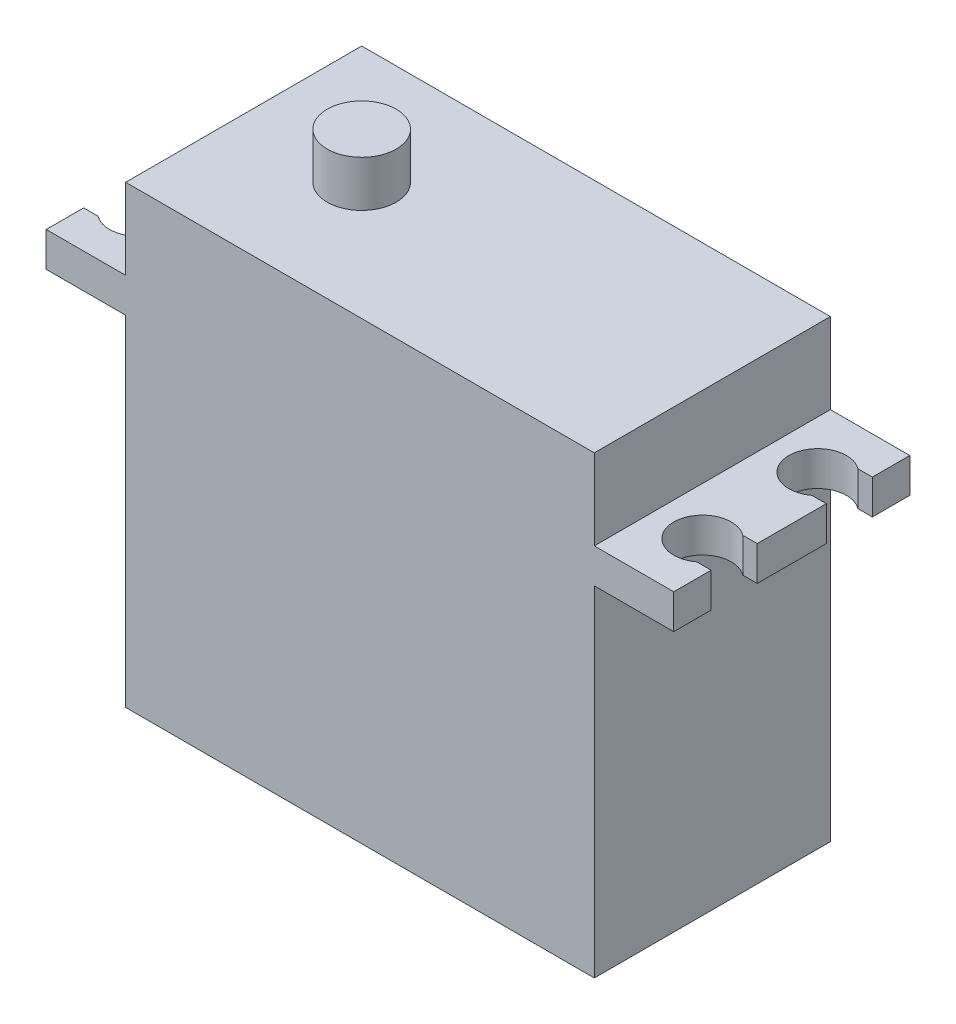
from build123d import *

# Parameters (mm, degrees)
SKETCH1_W            = 40.7
SKETCH1_H            = 20.5
BOSS_EXTRUDE1_DEPTH  = 39.5
SKETCH2_R            = 3
BOSS_EXTRUDE2_DEPTH  = 4
SKETCH3_W            = 54.5
SKETCH3_H            = 20.5
BOSS_EXTRUDE3_DEPTH  = 3
CUT_EXTRUDE1_DEPTH   = 60.634386054
MIRROR2_COPY_1_DEPTH = 60.634386054


with BuildPart() as part:
    # Sketch1 → Boss-Extrude1 (new body)
    with BuildSketch(Plane(origin=(0, 0, 0), x_dir=(1, 0, 0), z_dir=(0, 1, 0))):
        with Locations((20.35, 10.25)):
            Rectangle(SKETCH1_W, SKETCH1_H)
    extrude(amount=BOSS_EXTRUDE1_DEPTH)

    # Sketch2 → Boss-Extrude2 (add)
    with BuildSketch(Plane(origin=(0, 39.5, 0), x_dir=(1, 0, 0), z_dir=(0, 1, 0))):
        with Locations(Location((10.25, 10.25, 0), (0, 0, 90))):
            Circle(SKETCH2_R)
    extrude(amount=BOSS_EXTRUDE2_DEPTH)

    # Sketch3 → Boss-Extrude3 (add)
    with BuildSketch(Plane(origin=(0, 29.5, 0), x_dir=(1, 0, 0), z_dir=(0, 1, 0))):
        with Locations((20.35, 10.25)):
            Rectangle(SKETCH3_W, SKETCH3_H)
    extrude(amount=BOSS_EXTRUDE3_DEPTH)

    # Sketch4 → Cut-Extrude1 (cut, through all)
    with BuildSketch(Plane(origin=(0, 29.5, 0), x_dir=(1, 0, 0), z_dir=(0, 1, 0))):
        with BuildLine():
            Line((-5.65, 17.25), (-6.9, 17.25))
            Line((-6.9, 17.25), (-6.9, 13.25))
            Line((-6.9, 13.25), (-5.65, 13.25))
            ThreePointArc((-5.65, 13.25), (-1.65, 15.25), (-5.65, 17.25))
        make_face()
    cut_extrude1 = extrude(amount=CUT_EXTRUDE1_DEPTH, mode=Mode.SUBTRACT)

    # Mirror1: Cut-Extrude1 across plane
    add(cut_extrude1.mirror(Plane(origin=(0, 0, -10.25), x_dir=(1, 0, 0), z_dir=(0, 0, -1))), mode=Mode.SUBTRACT)

    # Mirror2: Cut-Extrude1 across plane
    add(cut_extrude1.mirror(Plane(origin=(20.35, 0, 0), x_dir=(0, 0, 1), z_dir=(1, 0, 0))), mode=Mode.SUBTRACT)

    # Mirror2 copy 1 sketch → Mirror2 copy 1 (cut, through all)
    with BuildSketch(Plane(origin=(40.7, 29.5, -20.5), x_dir=(-1, 0, 0), z_dir=(0, 1, 0))):
        with BuildLine():
            Line((-5.65, 17.25), (-6.9, 17.25))
            Line((-6.9, 17.25), (-6.9, 13.25))
            Line((-6.9, 13.25), (-5.65, 13.25))
            ThreePointArc((-5.65, 13.25), (-1.65, 15.25), (-5.65, 17.25))
        make_face()
    extrude(amount=MIRROR2_COPY_1_DEPTH, mode=Mode.SUBTRACT)


solid = part.part
